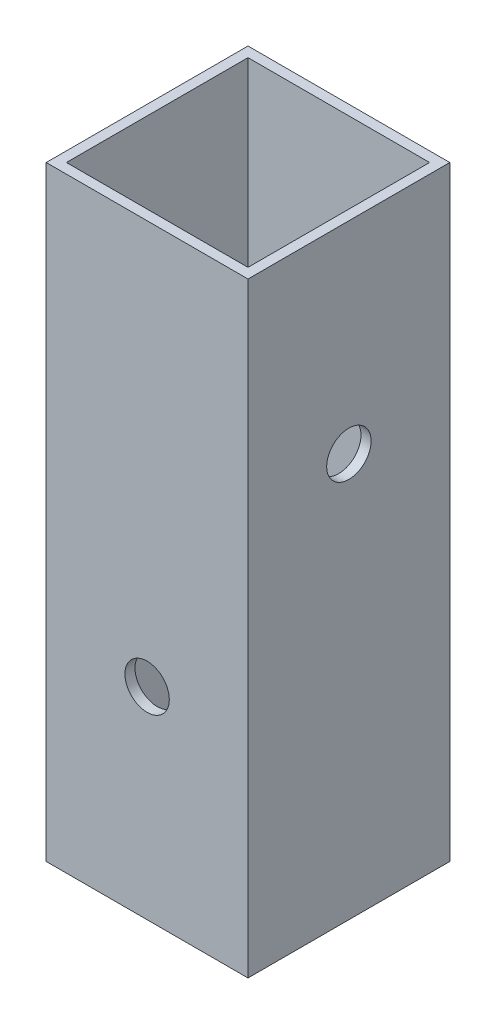
from build123d import *

# Parameters (mm, degrees)
EXTRUDE_1_DEPTH     = 280
SKETCH_2_R          = 2.2
CUT_EXTRUDE_1_DEPTH = 280
SKETCH_3_R          = 2.2
CUT_EXTRUDE_2_DEPTH = 20
CUT_EXTRUDE_3_DEPTH = 59
EXTRUDE_3_DEPTH     = 20
SKETCH_6_W          = 4.4
SKETCH_6_H          = 18
CUT_EXTRUDE_4_DEPTH = 20


with BuildPart() as part:
    # 草图1 → 凸台-拉伸1 (new body)
    with BuildSketch(Plane(origin=(0, 0, 0), x_dir=(1, 0, 0), z_dir=(0, 1, 0))):
        Polygon((10, 0), (10, 10), (0, 10), (-10, 10), (-10, 0), (-10, -10), (0, -10), (10, -10), align=None)
        Polygon((9, 0), (9, 9), (0, 9), (-9, 9), (-9, 0), (-9, -9), (0, -9), (9, -9), align=None, mode=Mode.SUBTRACT)
    extrude(amount=-EXTRUDE_1_DEPTH)

    # 草图2 → 切除-拉伸1 (cut)
    with BuildSketch(Plane.XY.offset(10)):
        with Locations(Location((0, -40, 0), (0, 0, 180))):
            Circle(SKETCH_2_R)
        with Locations(Location((0, -80, 0), (0, 0, 180))):
            Circle(SKETCH_2_R)
        with Locations(Location((0, -120, 0), (0, 0, 180))):
            Circle(SKETCH_2_R)
        with Locations(Location((0, -180, 0), (0, 0, 180))):
            Circle(SKETCH_2_R)
        with Locations(Location((0, -220, 0), (0, 0, 180))):
            Circle(SKETCH_2_R)
        with Locations(Location((0, -260, 0), (0, 0, 180))):
            Circle(SKETCH_2_R)
    extrude(amount=-CUT_EXTRUDE_1_DEPTH, mode=Mode.SUBTRACT)

    # 草图3 → 切除-拉伸2 (cut)
    with BuildSketch(Plane(origin=(10, 0, 0), x_dir=(0, 0, -1), z_dir=(1, 0, 0))):
        with Locations((0, -60)):
            Circle(SKETCH_3_R)
        with Locations((0, -100)):
            Circle(SKETCH_3_R)
        with Locations((0, -150)):
            Circle(SKETCH_3_R)
        with Locations((0, -200)):
            Circle(SKETCH_3_R)
        with Locations((0, -240)):
            Circle(SKETCH_3_R)
    extrude(amount=-CUT_EXTRUDE_2_DEPTH, mode=Mode.SUBTRACT)

    # 草图4 → 切除-拉伸3 (cut)
    with BuildSketch(Plane.XY.offset(10)):
        Polygon((0, -220), (10, -220), (10, 0), (-10, 0), (-10, -220), align=None)
    extrude(amount=-CUT_EXTRUDE_3_DEPTH, mode=Mode.SUBTRACT)

    # 草图5 → 凸台-拉伸3 (add)
    with BuildSketch(Plane.XY.offset(10)):
        with BuildLine():
            Line((-2.2, -220), (2.2, -220))
            ThreePointArc((2.2, -220), (0, -222.2), (-2.2, -220))
        make_face()
    extrude(amount=-EXTRUDE_3_DEPTH)

    # 草图6 → 切除-拉伸4 (cut)
    with BuildSketch(Plane(origin=(0, -220, 0), x_dir=(1, 0, 0), z_dir=(0, 1, 0))):
        Rectangle(SKETCH_6_W, SKETCH_6_H)
    extrude(amount=-CUT_EXTRUDE_4_DEPTH, mode=Mode.SUBTRACT)


solid = part.part
